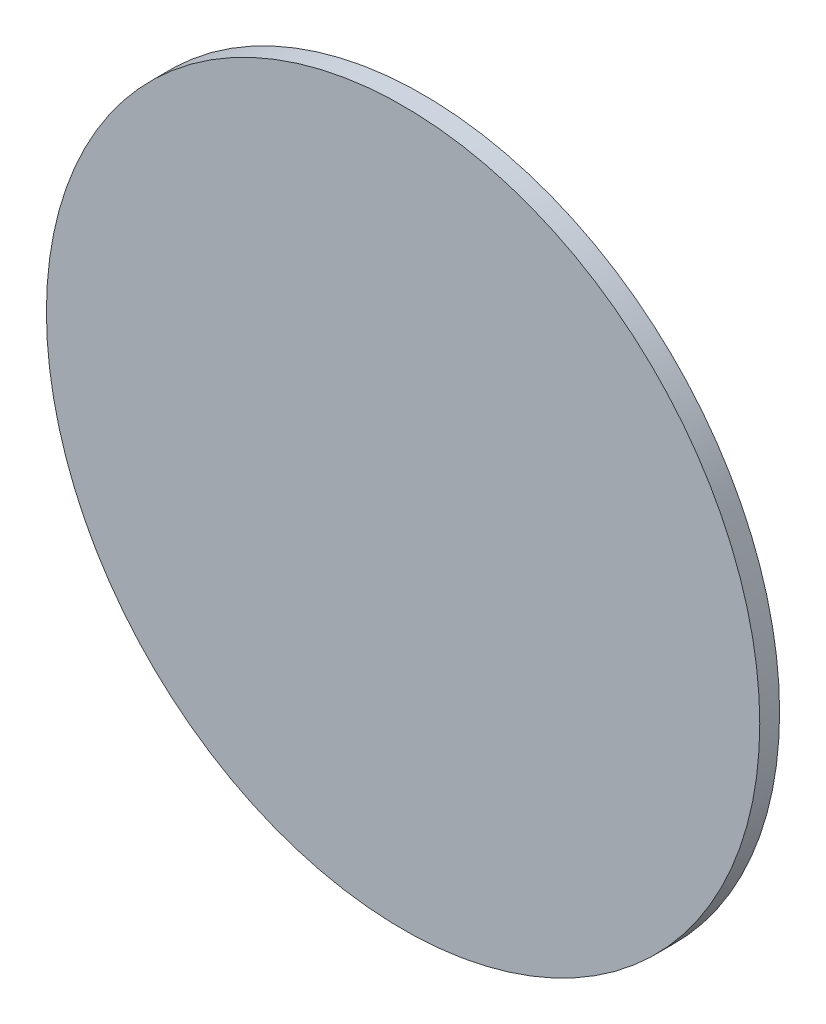
from build123d import *

# Parameters (mm, degrees)
SCHIZZO1_R                   = 90
ESTRUSIONE_ESTRUSIONE1_DEPTH = 5


with BuildPart() as part:
    # Schizzo1 → Estrusione-Estrusione1 (new body)
    with BuildSketch(Plane.XY):
        Circle(SCHIZZO1_R)
    extrude(amount=ESTRUSIONE_ESTRUSIONE1_DEPTH)


solid = part.part
